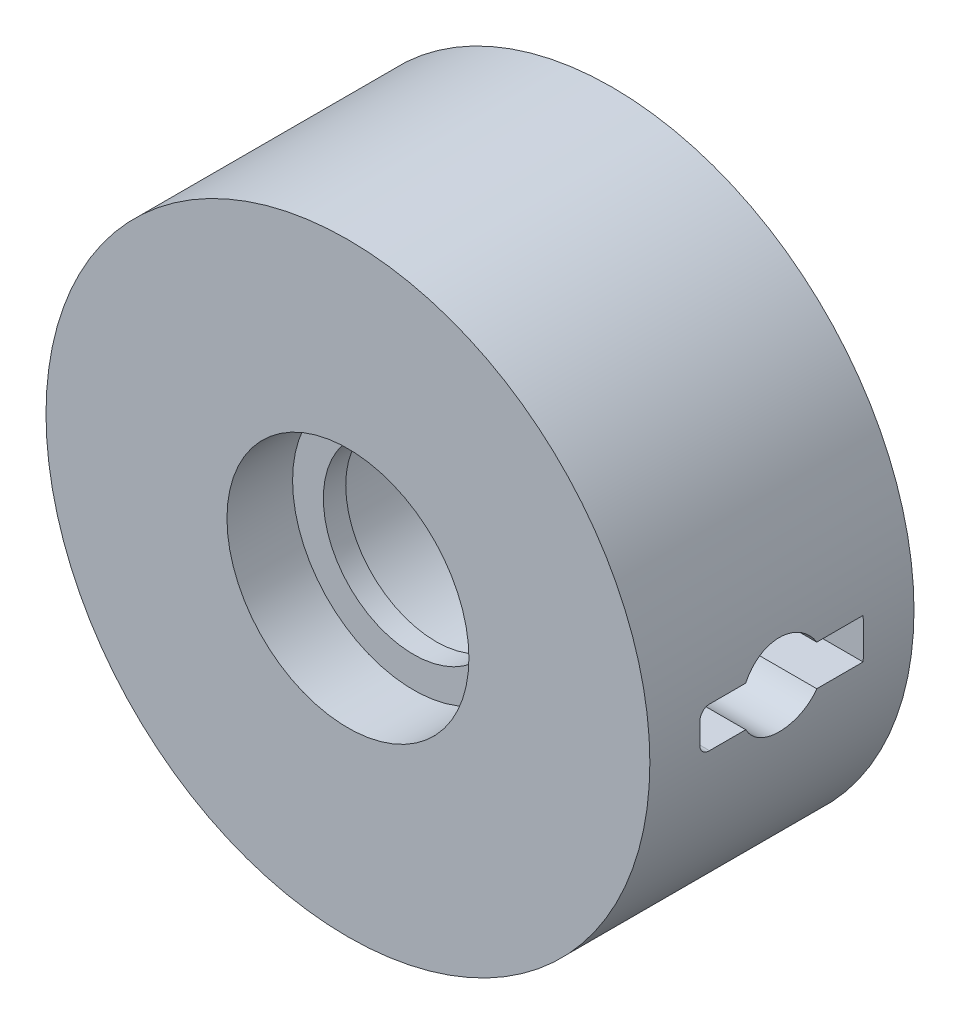
from build123d import *
from build123d.topology import SkipClean

# Parameters (mm, degrees)
SKETCH1_R           = 29.95
BOSS_EXTRUDE1_DEPTH = 12.7
SKETCH3_R           = 12
CUT_EXTRUDE2_DEPTH  = 45.218717756
SKETCH4_R           = 12
BOSS_EXTRUDE2_DEPTH = 2.2225
SKETCH5_R           = 8.95
CUT_EXTRUDE3_DEPTH  = 43.852874193
BOSS_EXTRUDE6_START = 13.5
SKETCH11_R          = 29.95
SKETCH11_R_2        = 12
BOSS_EXTRUDE6_DEPTH = 13.5
SKETCH12_R          = 4.05
CUT_EXTRUDE4_DEPTH  = 14.5
BOSS_EXTRUDE7_START = 4
SKETCH14_R          = 4.05
BOSS_EXTRUDE7_DEPTH = 4
SKETCH16_R          = 3
CUT_EXTRUDE5_DEPTH  = 4
CUT_EXTRUDE6_DEPTH  = 8


with BuildPart() as part:
    # Sketch1 → Boss-Extrude1 (new body)
    with BuildSketch(Plane.XY):
        Circle(SKETCH1_R)
    extrude(amount=BOSS_EXTRUDE1_DEPTH)

    # Sketch3 → Cut-Extrude2 (cut, through all)
    with BuildSketch(Plane(origin=(0, 0, 0), x_dir=(-1, 0, 0), z_dir=(0, 0, -1))):
        Circle(SKETCH3_R)
    extrude(amount=-CUT_EXTRUDE2_DEPTH, mode=Mode.SUBTRACT)

    # Sketch4 → Boss-Extrude2 (add)
    with BuildSketch(Plane(origin=(0, 0, 3.96875), x_dir=(-1, 0, 0), z_dir=(0, 0, -1))):
        Circle(SKETCH4_R)
    extrude(amount=-BOSS_EXTRUDE2_DEPTH)

    # Sketch5 → Cut-Extrude3 (cut, through all)
    with BuildSketch(Plane.XY.offset(6.19125)):
        Circle(SKETCH5_R)
    extrude(amount=-CUT_EXTRUDE3_DEPTH, mode=Mode.SUBTRACT)

    # Sketch11 → Boss-Extrude6 (add)
    with BuildSketch(Plane(origin=(0, 0, 0), x_dir=(-1, 0, 0), z_dir=(0, 0, -1)).offset(BOSS_EXTRUDE6_START)):
        Circle(SKETCH11_R)
        Circle(SKETCH11_R_2, mode=Mode.SUBTRACT)
    extrude(amount=-BOSS_EXTRUDE6_DEPTH)

    # Sketch12 → Cut-Extrude4 (cut)
    with BuildSketch(Plane(origin=(-29.95, 0, 6.19125), x_dir=(0, 0, 1), z_dir=(-1, 0, 0))):
        with Locations((-6.59125, 0)):
            Circle(SKETCH12_R)
    cut_extrude4 = extrude(amount=-CUT_EXTRUDE4_DEPTH, mode=Mode.SUBTRACT)

    # Sketch14 → Boss-Extrude7 (add)
    with BuildSketch(Plane(origin=(-16.95, 0, 6.19125), x_dir=(0, 0, 1), z_dir=(-1, 0, 0)).offset(BOSS_EXTRUDE7_START)):
        with Locations((-6.59125, 0)):
            Circle(SKETCH14_R)
    boss_extrude7 = extrude(amount=-BOSS_EXTRUDE7_DEPTH)

    # Sketch16 → Cut-Extrude5 (cut)
    with BuildSketch(Plane.ZY.offset(20.95)):
        with Locations((-0.4, 0)):
            Circle(SKETCH16_R)
    cut_extrude5 = extrude(amount=-CUT_EXTRUDE5_DEPTH, mode=Mode.SUBTRACT)

    # Sketch17 → Cut-Extrude6 (cut)
    with BuildSketch(Plane(origin=(-29.95, 0, 6.19125), x_dir=(0, 0, 1), z_dir=(-1, 0, 0))):
        with BuildLine():
            Line((0.530468331, 2), (-3.069531669, 2))
            ThreePointArc((-3.069531669, 2), (-2.54125, 0), (-3.069531669, -2))
            Line((-3.069531669, -2), (0.530468331, -2))
            ThreePointArc((0.530468331, -2), (1.237575112, -1.707106781), (1.530468331, -1))
            Line((1.530468331, -1), (1.530468331, 1))
            ThreePointArc((1.530468331, 1), (1.237575112, 1.707106781), (0.530468331, 2))
        make_face()
        with BuildLine():
            Line((-14.712968331, -2), (-10.112968331, -2))
            ThreePointArc((-10.112968331, -2), (-10.64125, 0), (-10.112968331, 2))
            Line((-10.112968331, 2), (-14.712968331, 2))
            Line((-14.712968331, 2), (-14.712968331, -2))
        make_face()
    cut_extrude6 = extrude(amount=-CUT_EXTRUDE6_DEPTH, mode=Mode.SUBTRACT)

    # Mirror1: Cut-Extrude4, Boss-Extrude7, Cut-Extrude5, Cut-Extrude6 across plane
    with SkipClean():  # the faces are left unmerged after this step: merging them gives an invalid solid
        add(cut_extrude4.mirror(Plane.ZY), mode=Mode.SUBTRACT)
        add(boss_extrude7.mirror(Plane.ZY))
        add(cut_extrude5.mirror(Plane.ZY), mode=Mode.SUBTRACT)
        add(cut_extrude6.mirror(Plane.ZY), mode=Mode.SUBTRACT)


solid = part.part
